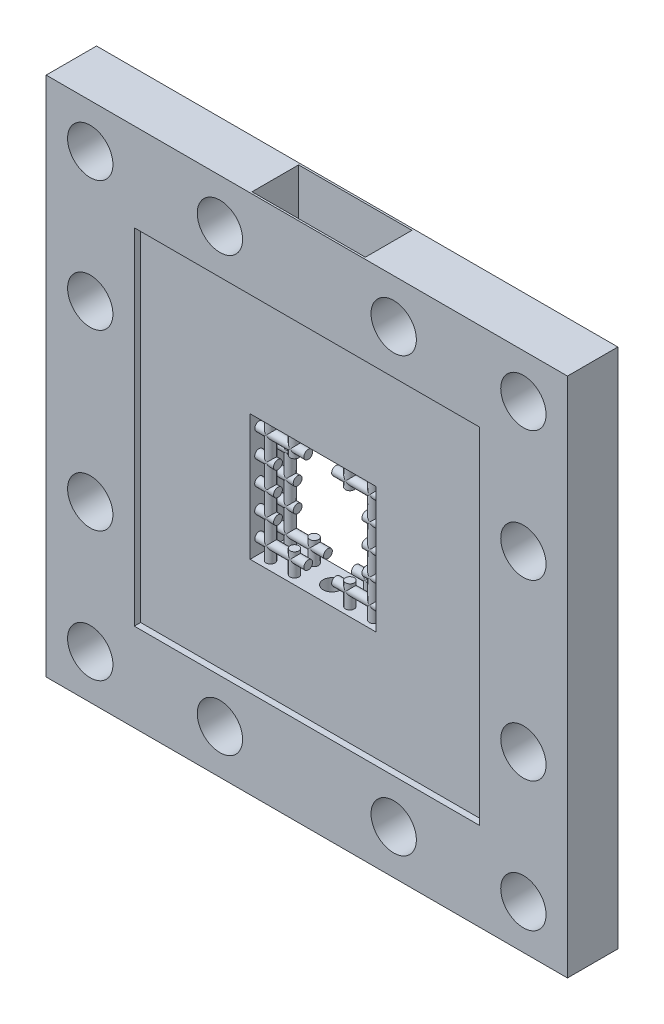
from build123d import *
from build123d.topology import SkipClean

# Parameters (mm, degrees)
SKETCH1_W                     = 20.7
SKETCH1_H                     = 20.7
BOSS_EXTRUDE1_DEPTH           = 2
SKETCH6_W                     = 13.7
SKETCH6_H                     = 13.7
CUT_EXTRUDE1_DEPTH            = 0.5
SKETCH11_R                    = 1.8
CUT_EXTRUDE3_DEPTH            = 2
LPATTERN1_COUNT               = 2
LPATTERN1_PITCH               = 10.3
LPATTERN2_COUNT               = 2
LPATTERN2_PITCH               = 10.3
SKETCH12_W                    = 10.01012294
SKETCH12_H                    = 10.01012294
CUT_EXTRUDE4_DEPTH            = 4
SKETCH14_R                    = 0.7
CUT_EXTRUDE5_DEPTH            = 20.7
SKETCH17_W                    = 9
SKETCH17_H                    = 3.7
CUT_EXTRUDE6_DEPTH            = 5
SKETCH23_R                    = 0.35
BOSS_EXTRUDE2_DEPTH           = 1.5
LPATTERN3_COUNT               = 2
LPATTERN3_PITCH               = 1.56
LPATTERN4_COUNT               = 2
LPATTERN4_PITCH               = 1.9
LPATTERN4_COL_COUNT           = 2
LPATTERN4_COL_PITCH           = 1.9
LPATTERN5_COPY_1_SKETCH_R     = 0.35
LPATTERN5_COPY_1_DEPTH        = 1.5
LPATTERN5_COPY_2_SKETCH_R     = 0.35
LPATTERN5_COPY_2_DEPTH        = 1.5
LPATTERN5_COL_COPY_1_SKETCH_R = 0.35
LPATTERN5_COL_COPY_1_DEPTH    = 1.5
LPATTERN5_COL_COPY_2_SKETCH_R = 0.35
LPATTERN5_COL_COPY_2_DEPTH    = 1.5
SKETCH25_R                    = 0.35
BOSS_EXTRUDE3_DEPTH           = 3.9
LPATTERN6_COUNT               = 2
LPATTERN6_PITCH               = 7.6
LPATTERN6_COUNT_DIR2          = 2
LPATTERN6_PITCH_DIR2          = 1.56
SKETCH26_R                    = 0.35
BOSS_EXTRUDE4_DEPTH           = 10
LPATTERN7_COUNT               = 2
LPATTERN7_PITCH               = 1.56
SKETCH27_R                    = 0.35
BOSS_EXTRUDE5_DEPTH           = 1.8
LPATTERN8_COUNT               = 2
LPATTERN8_PITCH               = 1.56
LPATTERN8_COUNT_DIR2          = 2
LPATTERN8_PITCH_DIR2          = 8.2


with BuildPart() as part:
    # Sketch1 → Boss-Extrude1 (new body)
    with BuildSketch(Plane.XY):
        with Locations((-10.35, 10.35)):
            Rectangle(SKETCH1_W, SKETCH1_H)
    extrude(amount=BOSS_EXTRUDE1_DEPTH)

    # Sketch6 → Cut-Extrude1 (cut)
    with BuildSketch(Plane.XY):
        with Locations((-6.85, 6.85)):
            Rectangle(SKETCH6_W, SKETCH6_H)
    extrude(amount=CUT_EXTRUDE1_DEPTH, mode=Mode.SUBTRACT)

    # Sketch11 → Cut-Extrude3 (cut)
    with BuildSketch(Plane.XY):
        with Locations((-17.2, 17.2)):
            Circle(SKETCH11_R)
    cut_extrude3 = extrude(amount=CUT_EXTRUDE3_DEPTH, mode=Mode.SUBTRACT)

    # LPattern1: Cut-Extrude3 ×2
    with Locations(*[(0, -i * LPATTERN1_PITCH, 0) for i in range(1, LPATTERN1_COUNT)]):
        add(cut_extrude3, mode=Mode.SUBTRACT)

    # LPattern2: Cut-Extrude3 ×2
    with Locations(*[(i * LPATTERN2_PITCH, 0, 0) for i in range(1, LPATTERN2_COUNT)]):
        add(cut_extrude3, mode=Mode.SUBTRACT)

    # Mirror4: part across plane


with BuildPart() as part_1:
    add(part.part)
    add(part.part.mirror(Plane.XY.offset(2)))

    # Sketch12 → Cut-Extrude4 (cut)
    with BuildSketch(Plane.XY.offset(3.5)):
        Rectangle(SKETCH12_W, SKETCH12_H)
    extrude(amount=-CUT_EXTRUDE4_DEPTH, mode=Mode.SUBTRACT)

    # Sketch14 → Cut-Extrude5 (cut)
    with BuildSketch(Plane(origin=(0, 20.7, 0), x_dir=(1, 0, 0), z_dir=(0, 1, 0))):
        with Locations((0, -2.001602537)):
            Circle(SKETCH14_R)
    extrude(amount=-CUT_EXTRUDE5_DEPTH, mode=Mode.SUBTRACT)

    # Sketch17 → Cut-Extrude6 (cut)
    with BuildSketch(Plane(origin=(0, 20.7, 0), x_dir=(1, 0, 0), z_dir=(0, 1, 0))):
        with Locations((0, -2.001602537)):
            Rectangle(SKETCH17_W, SKETCH17_H)
    extrude(amount=-CUT_EXTRUDE6_DEPTH, mode=Mode.SUBTRACT)

    # Mirror7: part across plane


with BuildPart() as part_2:
    add(part_1.part)
    add(part_1.part.mirror(Plane(origin=(0, 0, 0), x_dir=(0, 0, 1), z_dir=(0, -1, 0))))

    # Sketch23 → Boss-Extrude2 (add)
    with BuildSketch(Plane(origin=(-5.00506147, 0, 0), x_dir=(0, 0, -1), z_dir=(1, 0, 0))):
        with Locations(Location((-1.224980848, 0, 0), (0, 0, 180))):
            Circle(SKETCH23_R)
    boss_extrude2 = extrude(amount=BOSS_EXTRUDE2_DEPTH)

    # LPattern3: Boss-Extrude2 ×2
    with Locations(*[(0, 0, i * LPATTERN3_PITCH) for i in range(1, LPATTERN3_COUNT)]):
        add(boss_extrude2)

    # LPattern4: Boss-Extrude2 ×2
    with Locations(*[(0, -i * LPATTERN4_PITCH, 0) for i in range(1, LPATTERN4_COUNT)]):
        add(boss_extrude2)

    # LPattern4 col: Boss-Extrude2 ×2
    with Locations(*[(0, i * LPATTERN4_COL_PITCH, 0) for i in range(1, LPATTERN4_COL_COUNT)]):
        add(boss_extrude2)

    # LPattern5 copy 1 sketch → LPattern5 copy 1 (add)
    with BuildSketch(Plane(origin=(-5.00506147, -1.9, 1.56), x_dir=(0, 0, -1), z_dir=(1, 0, 0))):
        with Locations(Location((-1.224980848, 0, 0), (0, 0, 180))):
            Circle(LPATTERN5_COPY_1_SKETCH_R)
    extrude(amount=LPATTERN5_COPY_1_DEPTH)

    # LPattern5 copy 2 sketch → LPattern5 copy 2 (add)
    with BuildSketch(Plane(origin=(-5.00506147, -1.9, 0), x_dir=(0, 0, -1), z_dir=(1, 0, 0))):
        with Locations(Location((-1.224980848, 0, 0), (0, 0, 180))):
            Circle(LPATTERN5_COPY_2_SKETCH_R)
    extrude(amount=LPATTERN5_COPY_2_DEPTH)

    # LPattern5 col copy 1 sketch → LPattern5 col copy 1 (add)
    with BuildSketch(Plane(origin=(-5.00506147, 1.9, 1.56), x_dir=(0, 0, -1), z_dir=(1, 0, 0))):
        with Locations(Location((-1.224980848, 0, 0), (0, 0, 180))):
            Circle(LPATTERN5_COL_COPY_1_SKETCH_R)
    extrude(amount=LPATTERN5_COL_COPY_1_DEPTH)

    # LPattern5 col copy 2 sketch → LPattern5 col copy 2 (add)
    with BuildSketch(Plane(origin=(-5.00506147, 1.9, 0), x_dir=(0, 0, -1), z_dir=(1, 0, 0))):
        with Locations(Location((-1.224980848, 0, 0), (0, 0, 180))):
            Circle(LPATTERN5_COL_COPY_2_SKETCH_R)
    extrude(amount=LPATTERN5_COL_COPY_2_DEPTH)

    # Sketch25 → Boss-Extrude3 (add)
    with BuildSketch(Plane(origin=(-5.00506147, 0, 0), x_dir=(0, 0, -1), z_dir=(1, 0, 0))):
        with Locations(Location((-1.22, 3.8, 0), (0, 0, 180))):
            Circle(SKETCH25_R)
    boss_extrude3 = extrude(amount=BOSS_EXTRUDE3_DEPTH)

    # LPattern6: Boss-Extrude3 2 × 2
    with Locations(*[(0, -i * LPATTERN6_PITCH, j * LPATTERN6_PITCH_DIR2) for i in range(LPATTERN6_COUNT) for j in range(LPATTERN6_COUNT_DIR2) if (i, j) != (0, 0)]):
        add(boss_extrude3)

    # Sketch26 → Boss-Extrude4 (add)
    with BuildSketch(Plane.XZ.offset(-5.00506147)):
        with Locations(Location((-4.1, 1.22, 0), (0, 0, 90))):
            Circle(SKETCH26_R)
    boss_extrude4 = extrude(amount=BOSS_EXTRUDE4_DEPTH)

    # LPattern7: Boss-Extrude4 ×2
    with Locations(*[(0, 0, i * LPATTERN7_PITCH) for i in range(1, LPATTERN7_COUNT)]):
        add(boss_extrude4)

    # Sketch27 → Boss-Extrude5 (add)
    with BuildSketch(Plane(origin=(0, -5.00506147, 0), x_dir=(1, 0, 0), z_dir=(0, 1, 0))):
        with Locations((-2.2, -1.22)):
            Circle(SKETCH27_R)
    boss_extrude5 = extrude(amount=BOSS_EXTRUDE5_DEPTH)

    # LPattern8: Boss-Extrude5 2 × 2
    with Locations(*[(0, j * LPATTERN8_PITCH_DIR2, i * LPATTERN8_PITCH) for i in range(LPATTERN8_COUNT) for j in range(LPATTERN8_COUNT_DIR2) if (i, j) != (0, 0)]):
        add(boss_extrude5)

    # Mirror9: part across plane


with BuildPart() as part_3:
    with SkipClean():  # the faces are left unmerged after this step: merging them gives an invalid solid
        add(part_2.part)
        add(part_2.part.mirror(Plane(origin=(0, 0, 0), x_dir=(0, 0, 1), z_dir=(1, 0, 0))))


solid = part_3.part
